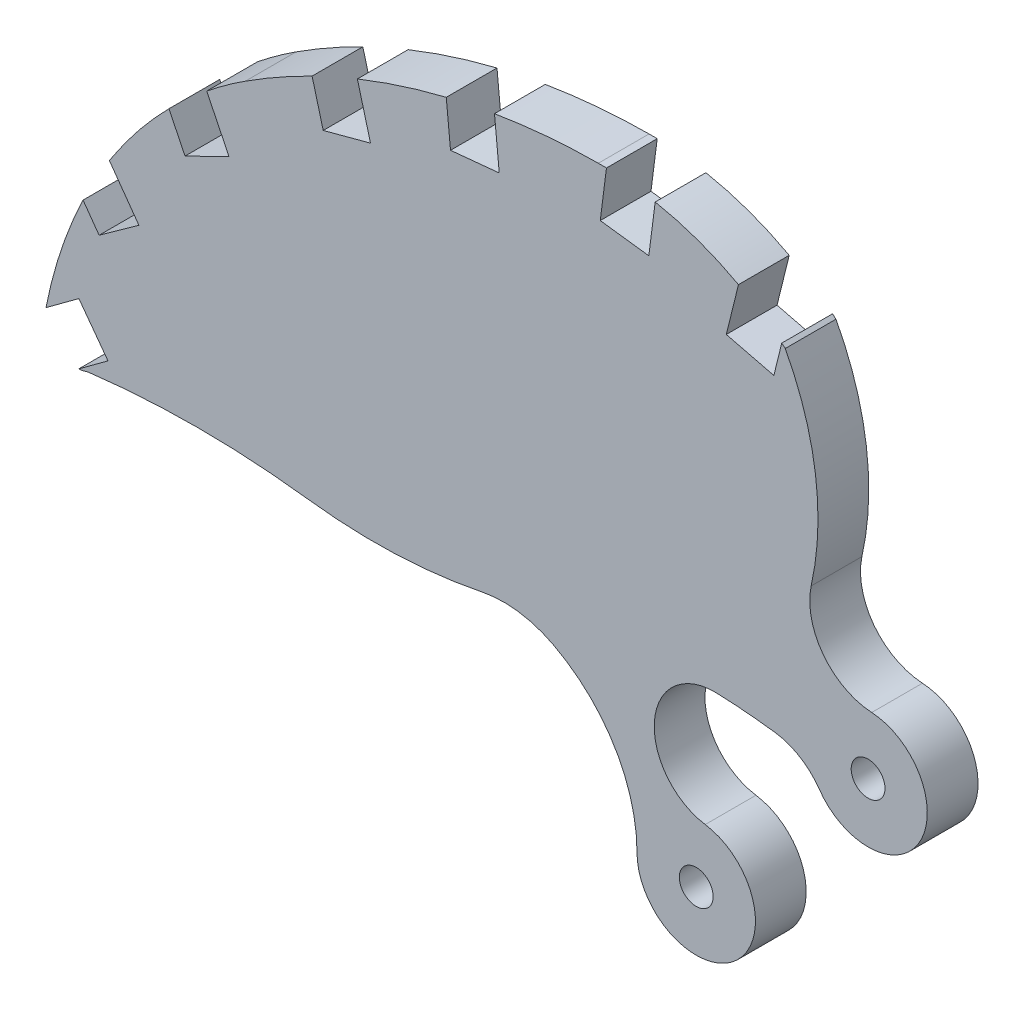
from build123d import *

# Parameters (mm, degrees)
SKETCH_1_R          = 1
EXTRUDE_1_DEPTH     = 3
CUT_EXTRUDE_1_DEPTH = 3
FILLET_1_R          = 6.35
FILLET_2_R          = 3.81


with BuildPart() as part:
    # 스케치1 → 보스-돌출1 (new body)
    with BuildSketch(Plane.XY):
        with BuildLine():
            ThreePointArc((0.531870722, -10.086704765), (-2.468285539, -6.240741756), (1.193231186, -3.018062075))
            ThreePointArc((1.193231186, -3.018062075), (3.977430532, -3.224017026), (6.736428382, -3.650765557))
            ThreePointArc((6.736428382, -3.650765557), (12.811387699, -5.208096803), (10.373680181, 0.570137648))
            ThreePointArc((10.373680181, 0.570137648), (7.511596171, 2.096172534), (6.79289024, 5.259046091))
            ThreePointArc((6.79289024, 5.259046091), (7.052126243, 11.092699457), (5.26272755, 16.651185512))
            ThreePointArc((5.26272755, 16.651185512), (0.091388125, 19.61858906), (-5.787768566, 20.610431722))
            ThreePointArc((-5.787768566, 20.610431722), (-16.663895396, 18.979214467), (-26.65376361, 14.379916953))
            ThreePointArc((-26.65376361, 14.379916953), (-30.97630157, 10.905433837), (-34.485646455, 6.611150914))
            ThreePointArc((-34.485646455, 6.611150914), (-36.933218927, 1.953038955), (-38.436256849, -3.089727649))
            ThreePointArc((-38.436256849, -3.089727649), (-37.817076352, -4.849129426), (-35.97891327, -5.165413449))
            ThreePointArc((-35.97891327, -5.165413449), (-29.469944847, -4.76402142), (-22.96129319, -5.170517559))
            ThreePointArc((-22.96129319, -5.170517559), (-17.052833669, -5.356485804), (-11.211694851, -4.447874001))
            ThreePointArc((-11.211694851, -4.447874001), (-5.68729426, -7.582685682), (-3.5, -13.546056371))
            ThreePointArc((-3.5, -13.546056371), (2.279084517, -16.20232702), (0.531870722, -10.086704765))
        make_face()
        with Locations((10.16, -2.923333517)):
            Circle(SKETCH_1_R, mode=Mode.SUBTRACT)
        with Locations((0, -13.546056371)):
            Circle(SKETCH_1_R, mode=Mode.SUBTRACT)
    extrude(amount=EXTRUDE_1_DEPTH)

    # 스케치3 → 컷-돌출1 (cut)
    with BuildSketch(Plane.XY.offset(3)):
        Polygon((-37.188543837, -5.783898323), (-34.775495789, -4.001428374), (-36.49557929, -1.672837008), (-38.908627338, -3.455306957), align=None)
        Polygon((-35.300313228, 2.168251474), (-32.945896506, 3.852812812), (-34.691555923, 6.292622886), (-37.045972645, 4.608061549), align=None)
        Polygon((-30.219801903, 8.760975192), (-27.619820697, 10.03420837), (-28.939233317, 12.728489413), (-31.539214523, 11.455256235), align=None)
        Polygon((-22.051978234, 14.155956059), (-19.255706545, 14.905549044), (-20.032486841, 17.803239913), (-22.828758529, 17.053646929), align=None)
        Polygon((-14.526759613, 16.903481061), (-11.645327955, 17.183439276), (-11.935440095, 20.169378818), (-14.816871753, 19.889420603), align=None)
        Polygon((-5.294168633, 20.707213916), (-2.42254789, 20.340036428), (-2.803042696, 17.364263637), (-5.674663439, 17.731441125), align=None)
        Polygon((2.496916602, 18.538725662), (5.307614816, 17.845183627), (4.588918406, 14.932542992), (1.778220193, 15.626085027), align=None)
    extrude(amount=-CUT_EXTRUDE_1_DEPTH, mode=Mode.SUBTRACT)

    # 필렛1
    fillet_1_edges = [part.edges().sort_by_distance(p)[0] for p in [
        (-11.211694851, -4.447874001, 1.5),
    ]]
    fillet(fillet_1_edges, radius=FILLET_1_R)

    # 필렛2
    fillet_2_edges = [part.edges().sort_by_distance(p)[0] for p in [
        (6.736428382, -3.650765557, 1.5),
    ]]
    fillet(fillet_2_edges, radius=FILLET_2_R)


solid = part.part
